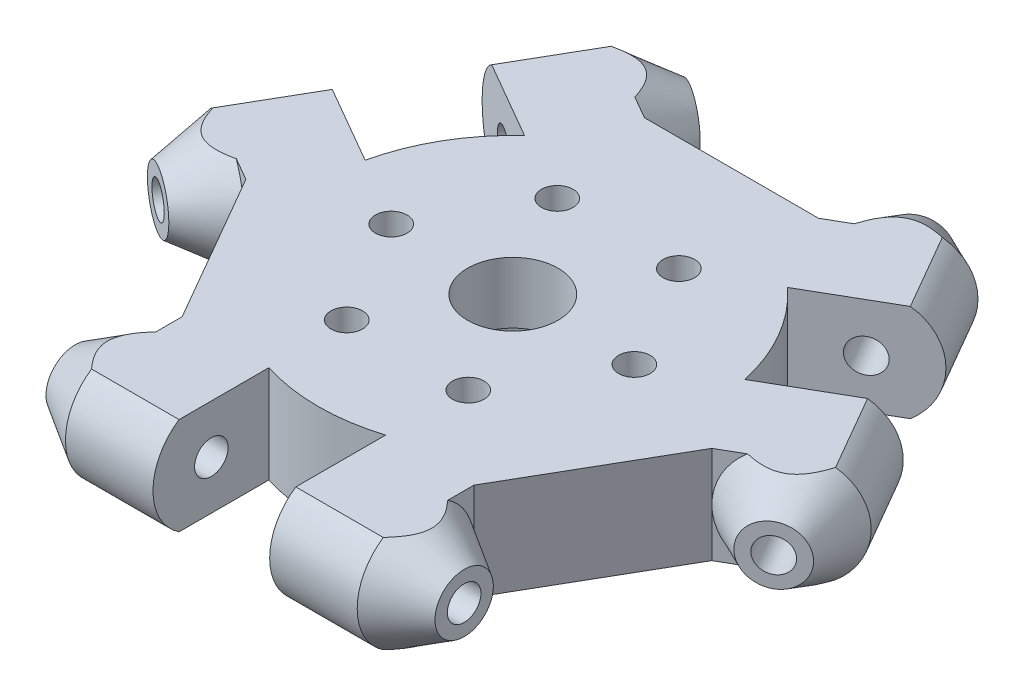
from build123d import *

# Parameters (mm, degrees)
BOSS_EXTRUDE1_DEPTH      = 5
BOSS_EXTRUDE1_DEPTH_BACK = 5
CIRPATTERN1_COUNT        = 3
SKETCH7_R                = 1.725
CUT_EXTRUDE2_DEPTH       = 47.868710659
CIRPATTERN2_COUNT        = 3
CUT_EXTRUDE3_DEPTH       = 47.751214304
CUT_EXTRUDE3_DEPTH_BACK  = 47.751214304
SKETCH8_R                = 8.5
SKETCH8_R_2              = 1.625
SKETCH9_R                = 8.5
SKETCH9_R_2              = 4.65
BOSS_EXTRUDE2_DEPTH      = 6.3


with BuildPart() as part:
    # Sketch4 → Boss-Extrude1 (new, two sides: drawn at the far end of the back side and taken through both)
    with BuildSketch(Plane(origin=(0, 0, 0), x_dir=(1, 0, 0), z_dir=(0, 1, 0)).offset(-BOSS_EXTRUDE1_DEPTH_BACK)):
        with BuildLine():
            Line((23.846787517, 20.696152423), (13.522711642, 14.735544437))
            ThreePointArc((13.522711642, 14.735544437), (17.320508076, 10), (19.522711642, 4.343239591))
            Line((19.522711642, 4.343239591), (29.846787517, 10.303847577))
            Line((29.846787517, 10.303847577), (34.346787517, 2.509618943))
            Line((34.346787517, 2.509618943), (23.954482672, -3.490381057))
            Line((23.954482672, -3.490381057), (15, -19))
            Line((15, -19), (15, -31))
            Line((15, -31), (6, -31))
            Line((6, -31), (6, -19.078784028))
            ThreePointArc((6, -19.078784028), (0, -20), (-6, -19.078784028))
            Line((-6, -19.078784028), (-6, -31))
            Line((-6, -31), (-15, -31))
            Line((-15, -31), (-15, -19))
            Line((-15, -19), (-23.954482672, -3.490381057))
            Line((-23.954482672, -3.490381057), (-34.346787517, 2.509618943))
            Line((-34.346787517, 2.509618943), (-29.846787517, 10.303847577))
            Line((-29.846787517, 10.303847577), (-19.522711642, 4.343239591))
            ThreePointArc((-19.522711642, 4.343239591), (-17.320508076, 10), (-13.522711642, 14.735544437))
            Line((-13.522711642, 14.735544437), (-23.846787517, 20.696152423))
            Line((-23.846787517, 20.696152423), (-19.346787517, 28.490381057))
            Line((-19.346787517, 28.490381057), (-8.954482672, 22.490381057))
            Line((-8.954482672, 22.490381057), (8.954482672, 22.490381057))
            Line((8.954482672, 22.490381057), (19.346787517, 28.490381057))
            Line((19.346787517, 28.490381057), (23.846787517, 20.696152423))
        make_face()
    extrude(amount=BOSS_EXTRUDE1_DEPTH + BOSS_EXTRUDE1_DEPTH_BACK)

    # Sketch6 → Revolve1 (revolve)
    with BuildSketch(Plane(origin=(0, 0, 0), x_dir=(1, 0, 0), z_dir=(0, 1, 0))):
        Polygon((-15, -25), (-20, -25), (-20, -28), (-15, -31), align=None)
        Polygon((15, -31), (15, -25), (20, -25), (20, -28), align=None)
    revolve1 = revolve(axis=Axis((-15, 0, 25), (1, 0, 0)))

    # CirPattern1: Revolve1 ×3 about axis
    cirpattern1_axis = Axis((0, 0, 0), (0, 1, 0))
    for i in range(1, CIRPATTERN1_COUNT):
        add(revolve1.rotate(cirpattern1_axis, i * 360 / CIRPATTERN1_COUNT))

    # Sketch7 → Cut-Extrude2 (cut, symmetric)
    with BuildSketch(Plane(origin=(0, 0, 0), x_dir=(0, 0, -1), z_dir=(1, 0, 0))):
        with Locations((-25, 0)):
            Circle(SKETCH7_R)
        with BuildLine():
            Line((-28.31662479, 5), (-19, 5))
            Line((-19, 5), (-19, 25))
            Line((-19, 25), (-39, 25))
            Line((-39, 25), (-39, -25))
            Line((-39, -25), (-19, -25))
            Line((-19, -25), (-19, -5))
            Line((-19, -5), (-28.31662479, -5))
            ThreePointArc((-28.31662479, -5), (-31, 0), (-28.31662479, 5))
        make_face()
    cut_extrude2 = extrude(amount=CUT_EXTRUDE2_DEPTH, both=True, mode=Mode.SUBTRACT)

    # CirPattern2: Cut-Extrude2 ×3 about axis
    cirpattern2_axis = Axis((0, 5, 0), (0, 1, 0))
    for i in range(1, CIRPATTERN2_COUNT):
        add(cut_extrude2.rotate(cirpattern2_axis, i * 360 / CIRPATTERN2_COUNT), mode=Mode.SUBTRACT)

    # Sketch8 → Cut-Extrude3 (cut, two sides: drawn at the far end of the back side and taken through both)
    with BuildSketch(Plane(origin=(0, 0, 0), x_dir=(1, 0, 0), z_dir=(0, 1, 0)).offset(-CUT_EXTRUDE3_DEPTH_BACK)):
        with Locations(Location((0, 0, 0), (0, 0, 270))):
            Circle(SKETCH8_R)
        with Locations(Location((-12.5, 0, 0), (0, 0, 270))):
            Circle(SKETCH8_R_2)
        with Locations(Location((-6.25, 10.825317547, 0), (0, 0, 270))):
            Circle(SKETCH8_R_2)
        with Locations(Location((6.25, 10.825317547, 0), (0, 0, 270))):
            Circle(SKETCH8_R_2)
        with Locations(Location((12.5, 0, 0), (0, 0, 270))):
            Circle(SKETCH8_R_2)
        with Locations(Location((6.25, -10.825317547, 0), (0, 0, 270))):
            Circle(SKETCH8_R_2)
        with Locations(Location((-6.25, -10.825317547, 0), (0, 0, 270))):
            Circle(SKETCH8_R_2)
    extrude(amount=CUT_EXTRUDE3_DEPTH + CUT_EXTRUDE3_DEPTH_BACK, mode=Mode.SUBTRACT)

    # Sketch9 → Boss-Extrude2 (add)
    with BuildSketch(Plane(origin=(0, 5, 0), x_dir=(1, 0, 0), z_dir=(0, 1, 0))):
        with Locations(Location((0, 0, 0), (0, 0, 270))):
            Circle(SKETCH9_R)
        with Locations(Location((0, 0, 0), (0, 0, 270))):
            Circle(SKETCH9_R_2, mode=Mode.SUBTRACT)
    extrude(amount=-BOSS_EXTRUDE2_DEPTH)


solid = part.part
